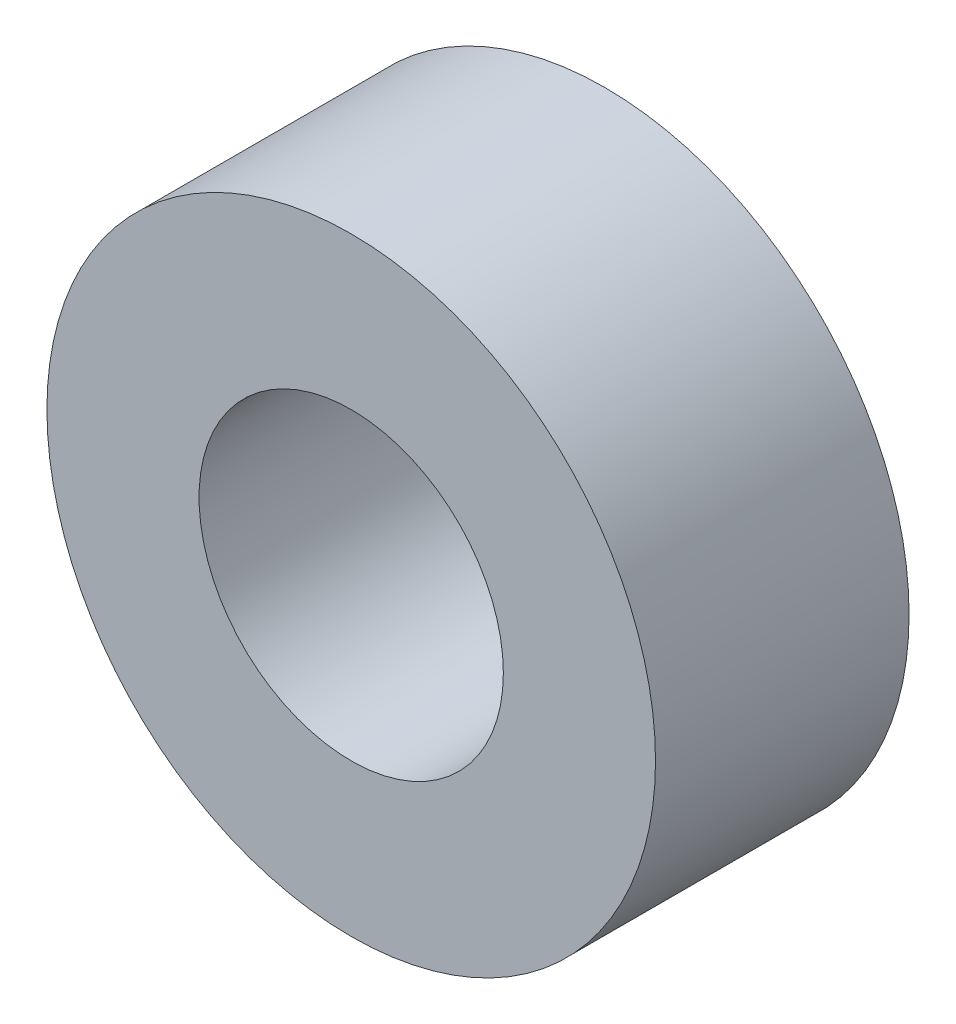
from build123d import *

# Parameters (mm, degrees)
SKETCH1_R           = 6
SKETCH1_R_2         = 3
BOSS_EXTRUDE1_DEPTH = 5


with BuildPart() as part:
    # Sketch1 → Boss-Extrude1 (new body)
    with BuildSketch(Plane.XY):
        Circle(SKETCH1_R)
        Circle(SKETCH1_R_2, mode=Mode.SUBTRACT)
    extrude(amount=BOSS_EXTRUDE1_DEPTH)


solid = part.part
